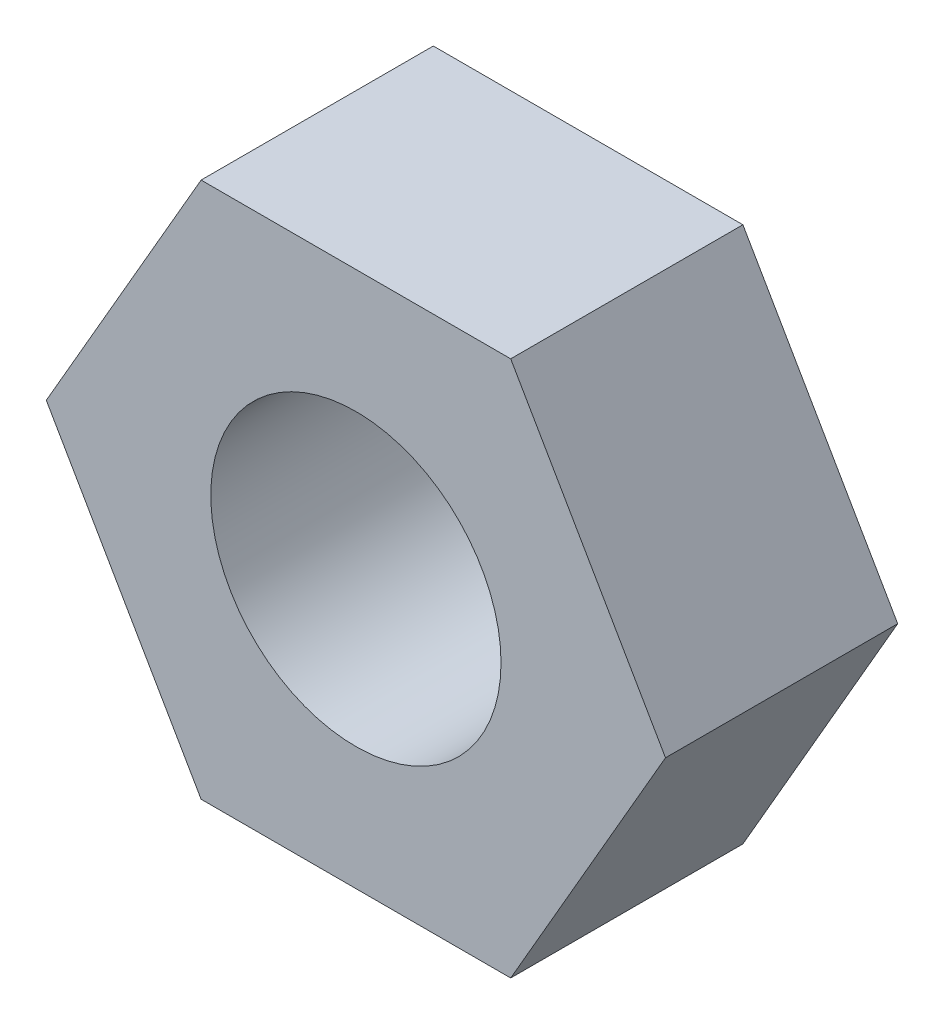
from build123d import *

# Parameters (mm, degrees)
ESQUISSE1_R      = 1.5
EXTRUSION1_DEPTH = 2.4


with BuildPart() as part:
    # Esquisse1 → Extrusion1 (new body)
    with BuildSketch(Plane.XY):
        Polygon((-1.6, -2.771281292), (1.6, -2.771281292), (3.2, 0), (1.6, 2.771281292), (-1.6, 2.771281292), (-3.2, 0), align=None)
        Circle(ESQUISSE1_R, mode=Mode.SUBTRACT)
    extrude(amount=EXTRUSION1_DEPTH)


solid = part.part
